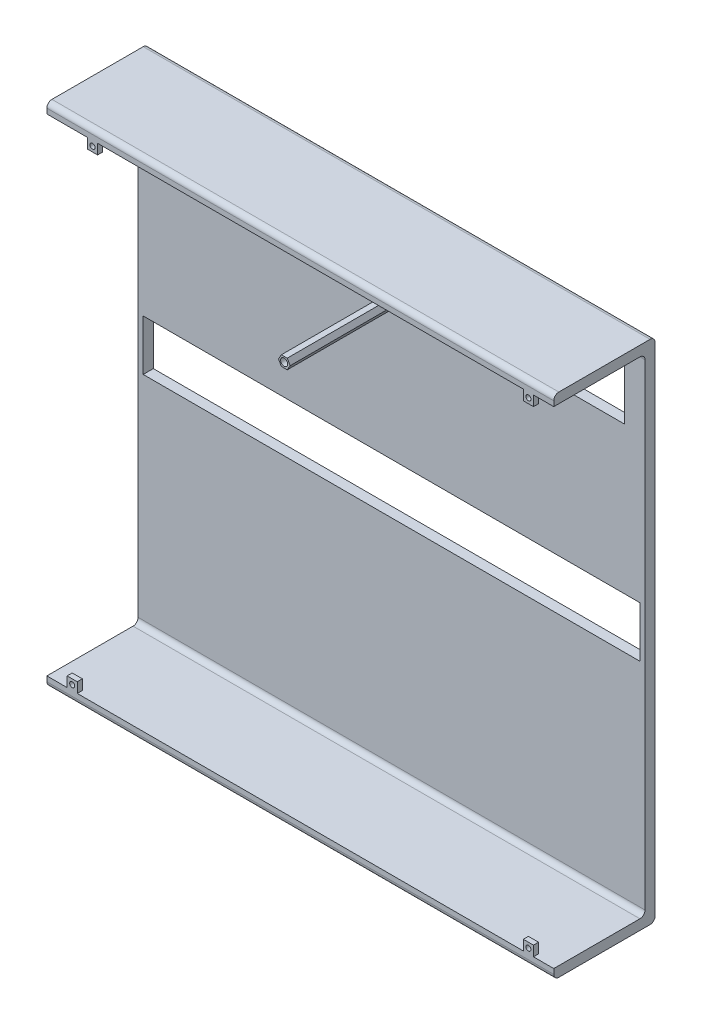
from build123d import *

# Parameters (mm, degrees)
CROQUIS1_W              = 50
CROQUIS1_H              = 50
SALIENTE_EXTRUIR1_DEPTH = 10
CROQUIS2_W              = 49
CROQUIS2_H              = 5
CORTAR_EXTRUIR2_DEPTH   = 6
CROQUIS3_W              = 10
CROQUIS3_H              = 5
CORTAR_EXTRUIR3_DEPTH   = 6
CROQUIS4_R              = 1
CORTAR_EXTRUIR4_DEPTH   = 6
CROQUIS5_W              = 9
CROQUIS5_H              = 48
CORTAR_EXTRUIR5_DEPTH   = 50
CROQUIS6_W              = 1
CROQUIS6_H              = 0.5
SALIENTE_EXTRUIR2_DEPTH = 1
CROQUIS7_W              = 1
CROQUIS7_H              = 0.5
SALIENTE_EXTRUIR3_DEPTH = 1
CROQUIS9_W              = 1
CROQUIS9_H              = 0.5
SALIENTE_EXTRUIR4_DEPTH = 1
CROQUIS10_W             = 1
CROQUIS10_H             = 0.5
SALIENTE_EXTRUIR5_DEPTH = 1
SALIENTE_EXTRUIR6_DEPTH = 10
CROQUIS12_R             = 0.35
CORTAR_EXTRUIR6_DEPTH   = 9
CROQUIS13_R             = 0.25
CORTAR_EXTRUIR7_DEPTH   = 2
CROQUIS14_R             = 0.25
CORTAR_EXTRUIR8_DEPTH   = 2
CROQUIS15_R             = 0.25
CORTAR_EXTRUIR9_DEPTH   = 2
CROQUIS16_R             = 0.25
CORTAR_EXTRUIR10_DEPTH  = 2
REDONDEO5_R             = 0.5
REDONDEO6_R             = 0.5
REDONDEO7_R             = 0.5
REDONDEO8_R             = 0.5
REDONDEO9_R             = 0.5
REDONDEO10_R            = 0.5


with BuildPart() as part:
    # Croquis1 → Saliente-Extruir1 (new body)
    with BuildSketch(Plane.XY):
        Rectangle(CROQUIS1_W, CROQUIS1_H)
    extrude(amount=SALIENTE_EXTRUIR1_DEPTH)

    # Croquis2 → Cortar-Extruir2 (cut)
    with BuildSketch(Plane(origin=(0, 0, 0), x_dir=(-1, 0, 0), z_dir=(0, 0, -1))):
        Rectangle(CROQUIS2_W, CROQUIS2_H)
    extrude(amount=-CORTAR_EXTRUIR2_DEPTH, mode=Mode.SUBTRACT)

    # Croquis3 → Cortar-Extruir3 (cut)
    with BuildSketch(Plane(origin=(0, 0, 0), x_dir=(-1, 0, 0), z_dir=(0, 0, -1))):
        with Locations((-18, 19.5)):
            Rectangle(CROQUIS3_W, CROQUIS3_H)
    extrude(amount=-CORTAR_EXTRUIR3_DEPTH, mode=Mode.SUBTRACT)

    # Croquis4 → Cortar-Extruir4 (cut)
    with BuildSketch(Plane(origin=(0, 0, 0), x_dir=(-1, 0, 0), z_dir=(0, 0, -1))):
        with Locations((23, 21)):
            Circle(CROQUIS4_R)
    extrude(amount=-CORTAR_EXTRUIR4_DEPTH, mode=Mode.SUBTRACT)

    # Croquis5 → Cortar-Extruir5 (cut)
    with BuildSketch(Plane(origin=(25, 0, 0), x_dir=(0, 0, -1), z_dir=(1, 0, 0))):
        with Locations((-5.5, 0)):
            Rectangle(CROQUIS5_W, CROQUIS5_H)
    extrude(amount=-CORTAR_EXTRUIR5_DEPTH, mode=Mode.SUBTRACT)

    # Croquis6 → Saliente-Extruir2 (add)
    with BuildSketch(Plane.XZ.offset(-24)):
        with Locations((-20.5, 9.75)):
            Rectangle(CROQUIS6_W, CROQUIS6_H)
    extrude(amount=SALIENTE_EXTRUIR2_DEPTH)

    # Croquis7 → Saliente-Extruir3 (add)
    with BuildSketch(Plane.XZ.offset(-24)):
        with Locations((22.5, 9.75)):
            Rectangle(CROQUIS7_W, CROQUIS7_H)
    extrude(amount=SALIENTE_EXTRUIR3_DEPTH)

    # Croquis9 → Saliente-Extruir4 (add)
    with BuildSketch(Plane(origin=(0, -24, 0), x_dir=(1, 0, 0), z_dir=(0, 1, 0))):
        with Locations((-22.5, -9.75)):
            Rectangle(CROQUIS9_W, CROQUIS9_H)
    extrude(amount=SALIENTE_EXTRUIR4_DEPTH)

    # Croquis10 → Saliente-Extruir5 (add)
    with BuildSketch(Plane(origin=(0, -24, 0), x_dir=(1, 0, 0), z_dir=(0, 1, 0))):
        with Locations((22.5, -9.75)):
            Rectangle(CROQUIS10_W, CROQUIS10_H)
    extrude(amount=SALIENTE_EXTRUIR5_DEPTH)

    # Croquis11 → Saliente-Extruir6 (add)
    with BuildSketch(Plane.XY.offset(1)):
        Polygon((0, 15.5), (-0.288675135, 16), (-0.866025404, 16), (-1.154700538, 15.5), (-0.866025404, 15), (-0.288675135, 15), align=None)
    extrude(amount=SALIENTE_EXTRUIR6_DEPTH)

    # Croquis12 → Cortar-Extruir6 (cut)
    with BuildSketch(Plane.XY.offset(11)):
        with Locations((-0.6, 15.5)):
            Circle(CROQUIS12_R)
    extrude(amount=-CORTAR_EXTRUIR6_DEPTH, mode=Mode.SUBTRACT)

    # Croquis13 → Cortar-Extruir7 (cut)
    with BuildSketch(Plane.XY.offset(10)):
        with Locations((-20.5, 23.5)):
            Circle(CROQUIS13_R)
    extrude(amount=-CORTAR_EXTRUIR7_DEPTH, mode=Mode.SUBTRACT)

    # Croquis14 → Cortar-Extruir8 (cut)
    with BuildSketch(Plane.XY.offset(10)):
        with Locations((22.5, 23.5)):
            Circle(CROQUIS14_R)
    extrude(amount=-CORTAR_EXTRUIR8_DEPTH, mode=Mode.SUBTRACT)

    # Croquis15 → Cortar-Extruir9 (cut)
    with BuildSketch(Plane.XY.offset(10)):
        with Locations((-22.5, -23.5)):
            Circle(CROQUIS15_R)
    extrude(amount=-CORTAR_EXTRUIR9_DEPTH, mode=Mode.SUBTRACT)

    # Croquis16 → Cortar-Extruir10 (cut)
    with BuildSketch(Plane.XY.offset(10)):
        with Locations((22.5, -23.5)):
            Circle(CROQUIS16_R)
    extrude(amount=-CORTAR_EXTRUIR10_DEPTH, mode=Mode.SUBTRACT)

    # Redondeo5
    redondeo5_edges = [part.edges().sort_by_distance(p)[0] for p in [
        (0, 25, 0),
    ]]
    fillet(redondeo5_edges, radius=REDONDEO5_R)

    # Redondeo6
    redondeo6_edges = [part.edges().sort_by_distance(p)[0] for p in [
        (0, -25, 0),
    ]]
    fillet(redondeo6_edges, radius=REDONDEO6_R)

    # Redondeo7
    redondeo7_edges = [part.edges().sort_by_distance(p)[0] for p in [
        (0, 24, 1),
    ]]
    fillet(redondeo7_edges, radius=REDONDEO7_R)

    # Redondeo8
    redondeo8_edges = [part.edges().sort_by_distance(p)[0] for p in [
        (0, -24, 1),
    ]]
    fillet(redondeo8_edges, radius=REDONDEO8_R)

    # Redondeo9
    redondeo9_edges = [part.edges().sort_by_distance(p)[0] for p in [
        (0, 25, 10),
    ]]
    fillet(redondeo9_edges, radius=REDONDEO9_R)

    # Redondeo10
    redondeo10_edges = [part.edges().sort_by_distance(p)[0] for p in [
        (0, -25, 10),
    ]]
    fillet(redondeo10_edges, radius=REDONDEO10_R)


solid = part.part
